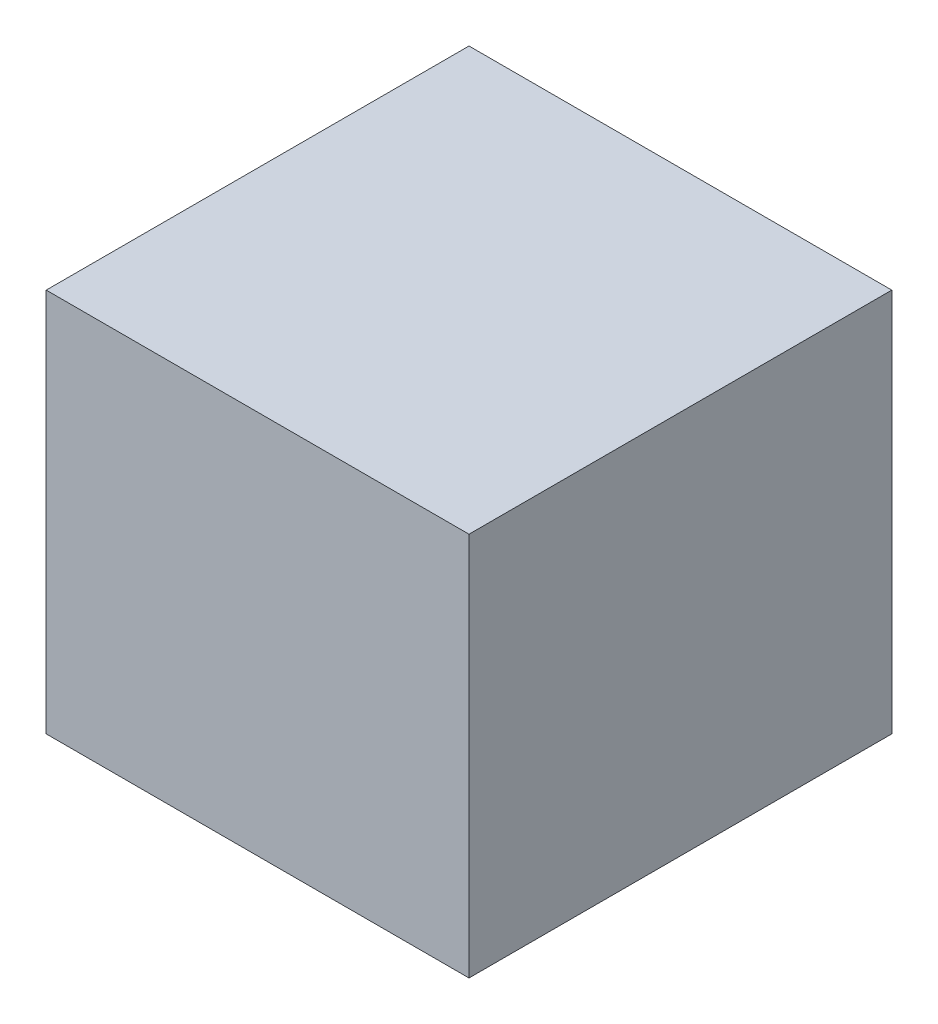
from build123d import *

# Parameters (mm, degrees)
SKETCH1_W           = 279.4
SKETCH1_H           = 279.4
BOSS_EXTRUDE1_DEPTH = 254


with BuildPart() as part:
    # Sketch1 → Boss-Extrude1 (new body)
    with BuildSketch(Plane(origin=(0, 0, 0), x_dir=(1, 0, 0), z_dir=(0, 1, 0))):
        Rectangle(SKETCH1_W, SKETCH1_H)
    extrude(amount=BOSS_EXTRUDE1_DEPTH)


solid = part.part
